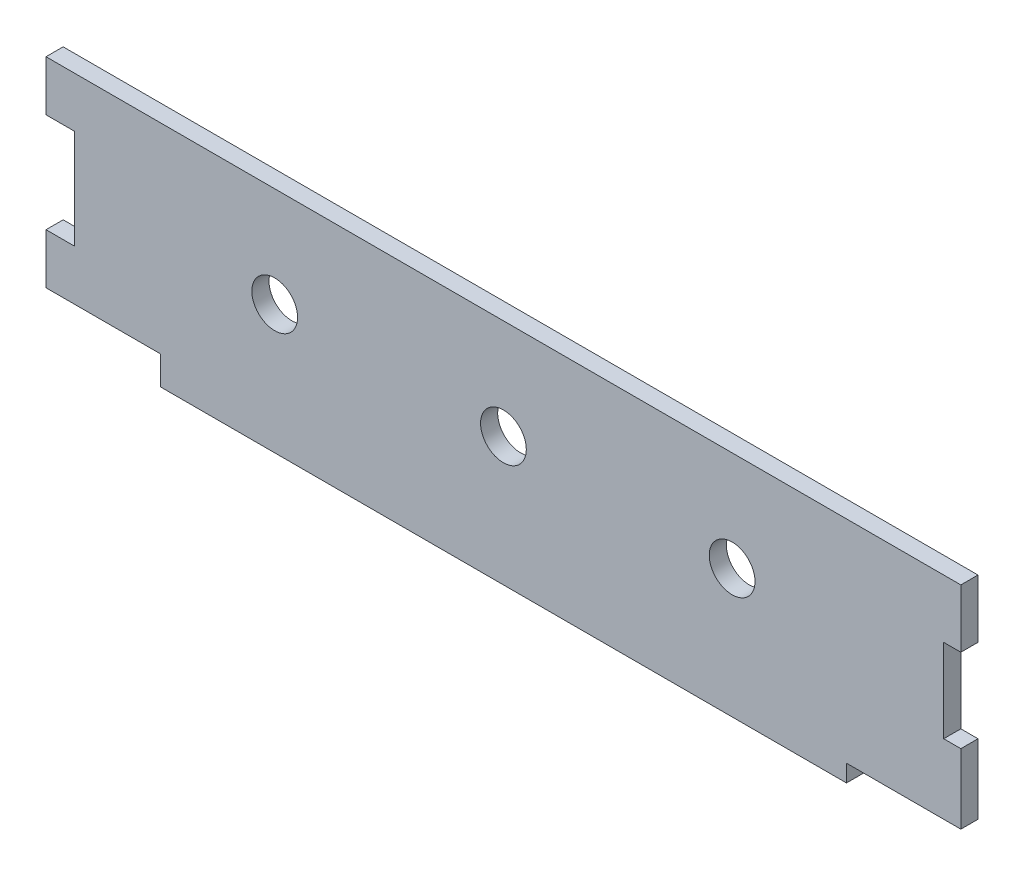
from build123d import *

# Parameters (mm, degrees)
CROQUIS1_R              = 2
SALIENTE_EXTRUIR1_DEPTH = 1.5


with BuildPart() as part:
    # Croquis1 → Saliente-Extruir1 (new body)
    with BuildSketch(Plane.XY):
        Polygon((-40, 8.75), (40, 8.75), (40, 3.65), (38.5, 3.65), (38.5, -3.65), (40, -3.65), (40, -9.75), (30, -9.75), (30, -11.25), (-30, -11.25), (-30, -8.75), (-40, -8.75), (-40, -4.35), (-37.5, -4.35), (-37.5, 4.35), (-40, 4.35), align=None)
        with Locations((20, 0)):
            Circle(CROQUIS1_R, mode=Mode.SUBTRACT)
        Circle(CROQUIS1_R, mode=Mode.SUBTRACT)
        with Locations((-20, 0)):
            Circle(CROQUIS1_R, mode=Mode.SUBTRACT)
    extrude(amount=SALIENTE_EXTRUIR1_DEPTH)


solid = part.part
